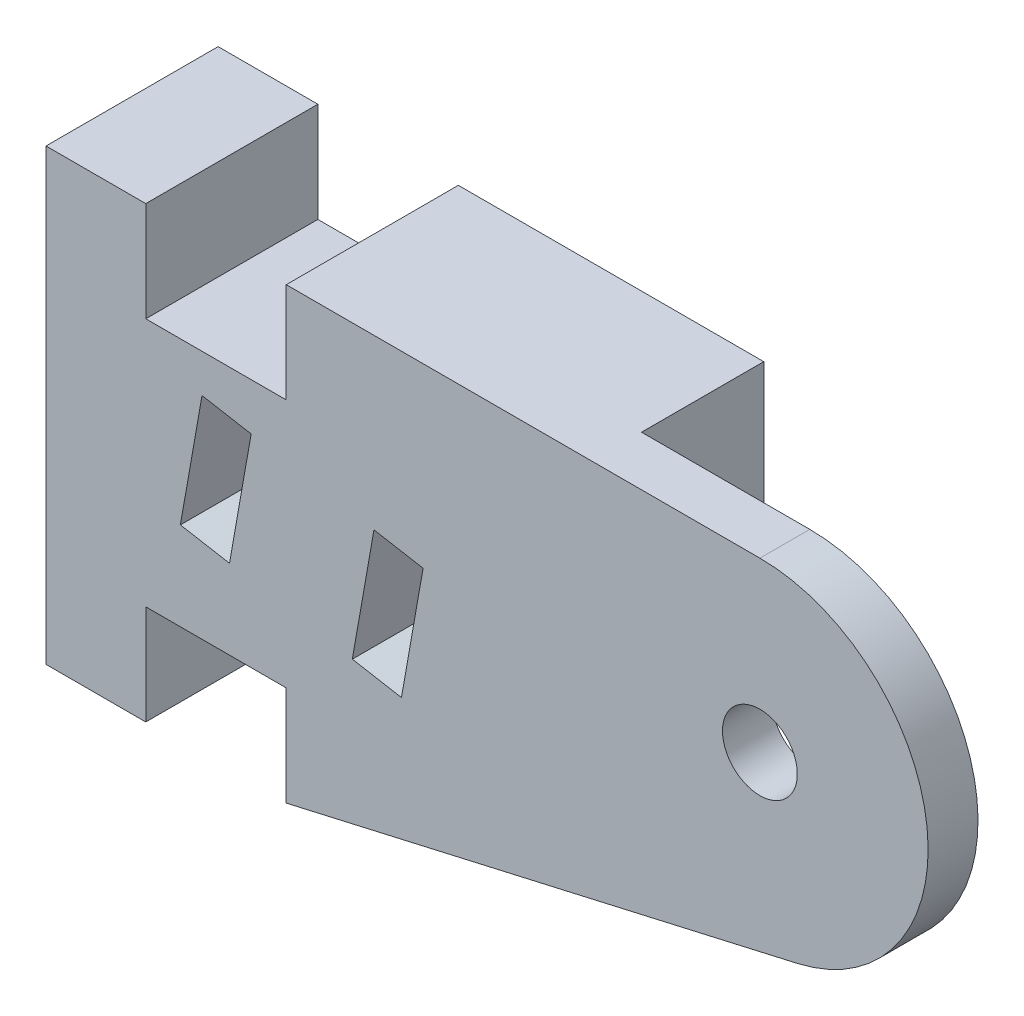
from build123d import *

# Parameters (mm, degrees)
SKETCH1_R                           = 1.5
BOSS_EXTRUDE1_DEPTH                 = 6.9
CUT_EXTRUDE2_DEPTH                  = 4.9
SKETCH5_R                           = 1
CUT_EXTRUDE3_DEPTH                  = 7
CUT_EXTRUDE4_REACH                  = 37.751
SKETCH6_R                           = 1
CUT_EXTRUDE4_DIRECTION_2_REACH      = 37.751
CUT_EXTRUDE4_DIRECTION_2_END_RADIUS = 1


with BuildPart() as part:
    # Sketch1 → Boss-Extrude1 (new body)
    with BuildSketch(Plane.XY):
        with BuildLine():
            Line((0, 0), (0, 18.000341084))
            Line((0, 18.000341084), (4, 18.000341084))
            Line((4, 18.000341084), (4, 14.000341084))
            Line((4, 14.000341084), (9.631516349, 14.000341084))
            Line((9.631516349, 14.000341084), (9.631516349, 18.000341084))
            Line((9.631516349, 18.000341084), (28.621516349, 18.000341084))
            ThreePointArc((28.621516349, 18.000341084), (35.324106187, 12.010882781), (30.123176491, 4.679535592))
            Line((30.123176491, 4.679535592), (9.631516349, 0))
            Line((9.631516349, 0), (9.631516349, 4))
            Line((9.631516349, 4), (4, 4))
            Line((4, 4), (4, 0))
            Line((4, 0), (0, 0))
        make_face()
        with Locations((28.621516349, 11.255296941)):
            Circle(SKETCH1_R, mode=Mode.SUBTRACT)
        Polygon((14.250450019, 5.974769403), (15.118690908, 10.898808168), (13.149075402, 11.246104524), (12.280834513, 6.322065759), align=None, mode=Mode.SUBTRACT)
        Polygon((6.255421131, 12.461641767), (8.225036637, 12.114345412), (7.356795748, 7.190306647), (5.387180242, 7.537603002), align=None, mode=Mode.SUBTRACT)
    extrude(amount=BOSS_EXTRUDE1_DEPTH)

    # Sketch4 → Cut-Extrude2 (cut)
    with BuildSketch(Plane.XY):
        with BuildLine():
            Line((21.876472206, 2.796294022), (30.123176491, 4.679535592))
            ThreePointArc((30.123176491, 4.679535592), (35.324106187, 12.010882781), (28.621516349, 18.000341084))
            Line((28.621516349, 18.000341084), (21.876472206, 18.000341084))
            Line((21.876472206, 18.000341084), (21.876472206, 2.796294022))
        make_face()
    extrude(amount=CUT_EXTRUDE2_DEPTH, mode=Mode.SUBTRACT)

    # Sketch5 → Cut-Extrude3 (cut)
    with BuildSketch(Plane.ZY):
        with Locations((2.45, 10.000341084)):
            Circle(SKETCH5_R)
    extrude(amount=-CUT_EXTRUDE3_DEPTH, mode=Mode.SUBTRACT)

    # Cut-Extrude4: up to this plane
    cut_extrude4_end = Plane(origin=(21.876472206, 18.000341084, 4.9), z_dir=(1, 0, 0))
    # Sketch6 → Cut-Extrude4 (cut, up to the surface)
    with BuildSketch(Plane(origin=(5.905346358, -1.041271893, 0), x_dir=(0, 0, 1), z_dir=(-0.984807753012208, 0.17364817766693114, 0)), mode=Mode.PRIVATE) as cut_extrude4_sk1:
        with Locations((2.45, 10.858563908)):
            Circle(SKETCH6_R)
    cut_extrude4_tool1 = split(extrude(cut_extrude4_sk1.sketch, amount=-CUT_EXTRUDE4_REACH, mode=Mode.PRIVATE), bisect_by=cut_extrude4_end, keep=Keep.BOTH, mode=Mode.PRIVATE)
    add(cut_extrude4_tool1.solids().sort_by_distance((7.790916, 9.652326, 2.45))[0], mode=Mode.SUBTRACT)

    # Cut-Extrude4 direction 2: up to this cylinder (the profile starts inside it)
    cut_extrude4_direction_2_end = Plane(origin=(7.790916, 10.000341084, 2.45), z_dir=(-1, 0, 0)) * Cylinder(CUT_EXTRUDE4_DIRECTION_2_END_RADIUS, 78.502, mode=Mode.PRIVATE)
    # Sketch6 → Cut-Extrude4 direction 2 (cut, up to the surface)
    with BuildSketch(Plane(origin=(5.905346358, -1.041271893, 0), x_dir=(0, 0, 1), z_dir=(-0.984807753012208, 0.17364817766693114, 0)), mode=Mode.PRIVATE) as cut_extrude4_direction_2_sk1:
        with Locations((2.45, 10.858563908)):
            Circle(SKETCH6_R)
    cut_extrude4_direction_2_tool1 = extrude(cut_extrude4_direction_2_sk1.sketch, amount=CUT_EXTRUDE4_DIRECTION_2_REACH, mode=Mode.PRIVATE) & cut_extrude4_direction_2_end
    add(cut_extrude4_direction_2_tool1.solids().sort_by_distance((7.790916, 9.652326, 2.45))[0], mode=Mode.SUBTRACT)


solid = part.part
